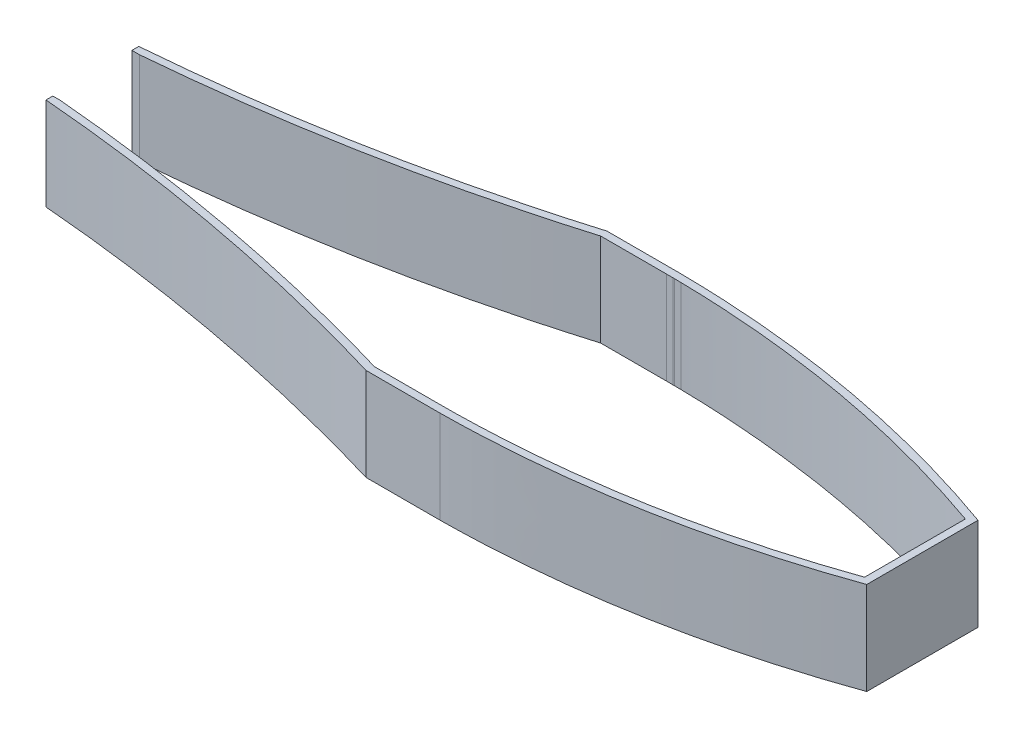
from build123d import *
from build123d.topology import SkipClean

# Parameters (mm, degrees)
BOSS_EXTRUDE1_DEPTH = 12.5
SKETCH2_R           = 1.5
CUT_EXTRUDE1_DEPTH  = 106.770979153
BOSS_EXTRUDE2_DEPTH = 12.5
SKETCH5_W           = 219.75
SKETCH5_H           = 4
CUT_EXTRUDE4_DEPTH  = 133.741525292
CUT_EXTRUDE5_DEPTH  = 133.741525292
SKETCH7_W           = 2
SKETCH7_H           = 21.32404315
CUT_EXTRUDE6_DEPTH  = 133.741525292


with BuildPart() as part:
    # Sketch1 → Boss-Extrude1 (new, symmetric)
    with BuildSketch(Plane(origin=(0, 0, 0), x_dir=(1, 0, 0), z_dir=(0, 1, 0))):
        with BuildLine():
            Line((0, 32.5), (0, 0))
            Line((0, 0), (97.5, 0))
            Line((97.5, 0), (97.5, 15))
            add(Edge.make_bspline(
                [(97.5, 15), (49.867333034, 31.979096348), (0, 32.5)],
                knots=[0, 0, 0, 1, 1, 1], degree=2))
        make_face()
        with BuildLine():
            add(Edge.make_bspline(
                [(2, 30.472180979), (5.973421581, 30.403851063), (13.928614977, 30.107916443), (29.720259647, 28.881516286), (49.306403631, 26.158418674), (68.681154035, 21.845288993), (84.040035566, 17.446698519), (91.704019985, 14.92011128), (95.5, 13.586278965)],
                knots=[0.968736419, 0.968736419, 0.968736419, 0.968736419, 1.089431795, 1.210127171, 1.451517923, 1.692908675, 1.813604051, 1.934299427, 1.934299427, 1.934299427, 1.934299427], degree=3))
            Line((95.5, 13.586278965), (95.5, 2))
            Line((95.5, 2), (2, 2))
            Line((2, 2), (2, 30.472180979))
        make_face(mode=Mode.SUBTRACT)
    boss_extrude1 = extrude(amount=BOSS_EXTRUDE1_DEPTH, both=True)

    # Sketch2 → Cut-Extrude1 (cut, through all)
    with BuildSketch(Plane(origin=(0, 12.5, 0), x_dir=(1, 0, 0), z_dir=(0, 1, 0))):
        with Locations((0, 29)):
            Circle(SKETCH2_R)
        with Locations((94, 0)):
            Circle(SKETCH2_R)
    extrude(amount=-CUT_EXTRUDE1_DEPTH, mode=Mode.SUBTRACT)

    # Sketch3 → Boss-Extrude2 (add, symmetric)
    with BuildSketch(Plane(origin=(0, 0, 0), x_dir=(1, 0, 0), z_dir=(0, 1, 0))):
        with BuildLine():
            Line((0, 0), (0, 27.5))
            ThreePointArc((0, 27.5), (-1.5, 29), (0, 30.5))
            Line((0, 30.5), (0, 32.5))
            Line((0, 32.5), (-20, 32.5))
            add(Edge.make_bspline(
                [(-20, 32.5), (-72.079745639, 16.987169574), (-126.25, 12.5)],
                knots=[0.512731404, 0.512731404, 0.512731404, 1.512731404, 1.512731404, 1.512731404], degree=2))
            Line((-126.25, 12.5), (-126.25, 0))
            Line((-126.25, 0), (-117.75, 0))
            ThreePointArc((-117.75, 0), (-116.25, 1.5), (-114.75, 0))
            Line((-114.75, 0), (-87.75, 0))
            ThreePointArc((-87.75, 0), (-86.25, 1.5), (-84.75, 0))
            Line((-84.75, 0), (-57.75, 0))
            ThreePointArc((-57.75, 0), (-56.25, 1.5), (-54.75, 0))
            Line((-54.75, 0), (0, 0))
        make_face()
        with BuildLine():
            Line((-124.25, 2), (-124.25, 10.662021575))
            add(Edge.make_bspline(
                [(-124.25, 10.662021575), (-115.390155068, 11.4268576), (-97.68648523, 13.405544976), (-71.433121422, 17.700076016), (-45.431410048, 23.321580155), (-28.233073927, 27.965983779), (-19.708743244, 30.5)],
                knots=[0.01687811, 0.01687811, 0.01687811, 0.01687811, 0.261989852, 0.507101595, 0.752213337, 0.99732508, 0.99732508, 0.99732508, 0.99732508], degree=3))
            Line((-19.708743244, 30.5), (-2, 30.5))
            Line((-2, 30.5), (-2, 2))
            Line((-2, 2), (-124.25, 2))
        make_face(mode=Mode.SUBTRACT)
    boss_extrude2 = extrude(amount=BOSS_EXTRUDE2_DEPTH, both=True)

    # Mirror1: Boss-Extrude1, Boss-Extrude2 across plane
    with SkipClean():  # the faces are left unmerged after this step: merging them gives an invalid solid
        add(boss_extrude1.mirror(Plane.XY))
        add(boss_extrude2.mirror(Plane.XY))

    # Sketch5 → Cut-Extrude4 (cut, through all)
    with BuildSketch(Plane(origin=(0, 12.5, 0), x_dir=(1, 0, 0), z_dir=(0, 1, 0))):
        with Locations((-14.375, 0)):
            Rectangle(SKETCH5_W, SKETCH5_H)
    extrude(amount=-CUT_EXTRUDE4_DEPTH, mode=Mode.SUBTRACT)

    # Sketch6 → Cut-Extrude5 (cut, through all)
    with BuildSketch(Plane(origin=(0, 12.5, 0), x_dir=(1, 0, 0), z_dir=(0, 1, 0))):
        Polygon((-2, 2), (2, 2), (2, 30.472180979), (-2, 30.5), align=None)
    cut_extrude5 = extrude(amount=-CUT_EXTRUDE5_DEPTH, mode=Mode.SUBTRACT)

    # Mirror2: Cut-Extrude5 across plane
    add(cut_extrude5.mirror(Plane.XY), mode=Mode.SUBTRACT)

    # Sketch7 → Cut-Extrude6 (cut, through all)
    with BuildSketch(Plane(origin=(0, 12.5, 0), x_dir=(1, 0, 0), z_dir=(0, 1, 0))):
        with Locations((-125.25, 0)):
            Rectangle(SKETCH7_W, SKETCH7_H)
    extrude(amount=-CUT_EXTRUDE6_DEPTH, mode=Mode.SUBTRACT)


solid = part.part
